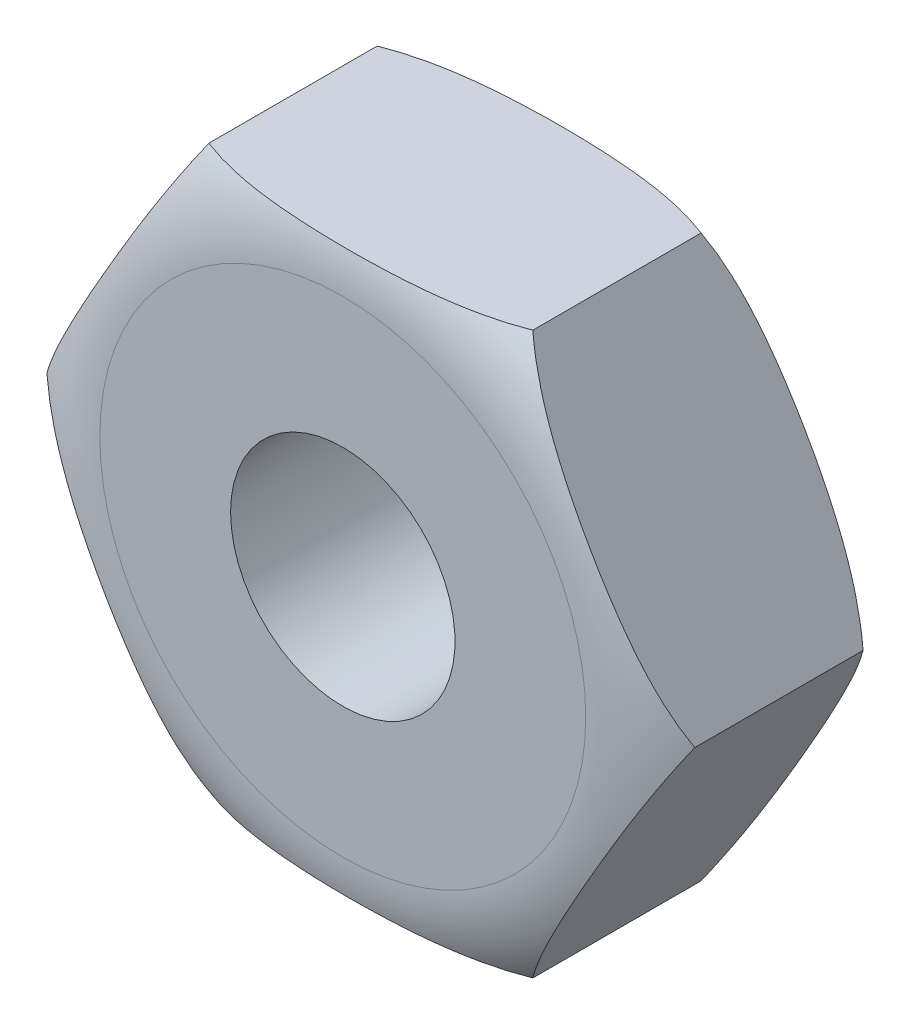
from build123d import *

# Parameters (mm, degrees)
EXTRUDE_319_DEPTH = 0.8
HOLE_WIZARD_1_D   = 1.6


with BuildPart() as part:
    # 草图1 → Extrude 319 (new, symmetric)
    with BuildSketch(Plane.XY):
        Polygon((1.154700538, 2), (-1.154700538, 2), (-2.309401077, 0), (-1.154700538, -2), (1.154700538, -2), (2.309401077, 0), align=None)
    extrude(amount=EXTRUDE_319_DEPTH, both=True)

    # 草图2 → 切除-旋转1 (revolve, cut)
    with BuildSketch(Plane(origin=(0, 0, 0), x_dir=(1, 0, 0), z_dir=(0, 1, 0))):
        with BuildLine():
            Line((1.732050808, 0.8), (2.309401077, 0.8))
            Line((2.309401077, 0.8), (2.309401077, 0.6))
            ThreePointArc((2.309401077, 0.6), (2.037555854, 0.74858377), (1.732050808, 0.8))
        make_face()
        with BuildLine():
            Line((2.309401077, -0.8), (2.309401077, -0.6))
            ThreePointArc((2.309401077, -0.6), (2.037555854, -0.74858377), (1.732050808, -0.8))
            Line((1.732050808, -0.8), (2.309401077, -0.8))
        make_face()
    revolve(axis=Axis((0, 0, 0), (0, 0, -1)), mode=Mode.SUBTRACT)

    # Hole Wizard 1 (through all)
    with Locations(Plane(origin=(0, 0, -0.8), x_dir=(-1, 0, 0), z_dir=(0, 0, -1))):
        with Locations((0, 0)):
            Hole(HOLE_WIZARD_1_D / 2)


solid = part.part
